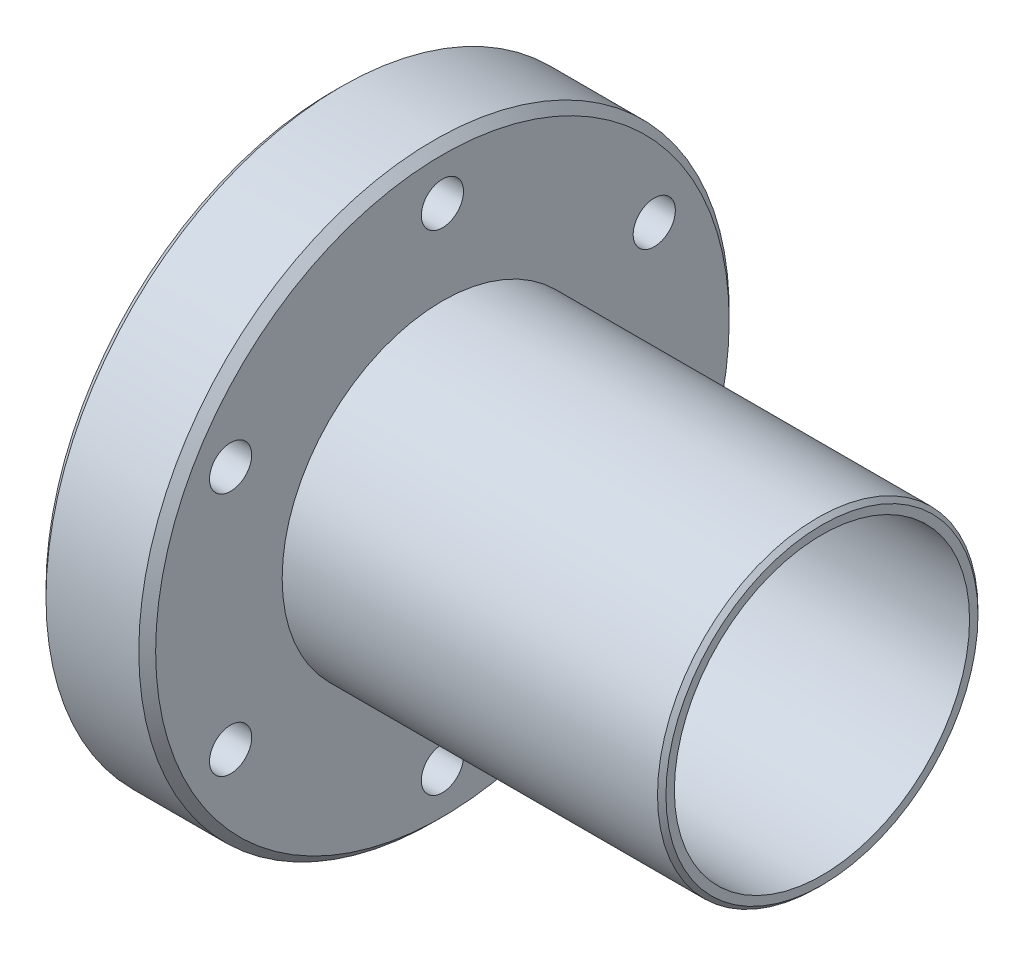
from build123d import *

# Parameters (mm, degrees)
HOLE_WIZARD_M6_1_D       = 5
PATTERN_CIRCULAR_1_COUNT = 6
CHAMFER_1_SIZE           = 1
CHAMFER_2_SIZE           = 1
CHAMFER_3_SIZE           = 0.5


with BuildPart() as part:
    # 스케치1 → 회전1 (revolve)
    with BuildSketch(Plane.XY, mode=Mode.PRIVATE) as revolve_1_sk:
        Polygon((0, 17.5), (0, 35), (13, 35), (13, 19), (58, 19), (58, 17.5), align=None)
    revolve(revolve_1_sk.sketch.rotate(Axis((0, 0, 0), (1, 0, 0)), 90), axis=Axis((0, 0, 0), (1, 0, 0)))

    # M6 나사 구멍1 (through all)
    with Locations(Plane.ZY):
        with Locations((0, 29)):
            hole_wizard_m6_1 = Hole(HOLE_WIZARD_M6_1_D / 2)

    # 원형 패턴1: M6 나사 구멍1 ×6 about axis
    pattern_circular_1_axis = Axis((0, 0, 0), (1, 0, 0))
    for i in range(1, PATTERN_CIRCULAR_1_COUNT):
        add(hole_wizard_m6_1.rotate(pattern_circular_1_axis, i * 360 / PATTERN_CIRCULAR_1_COUNT), mode=Mode.SUBTRACT)

    # 모따기1
    chamfer_1_edges = [part.edges().sort_by_distance(p)[0] for p in [
        (0, 0, -35),
    ]]
    chamfer(chamfer_1_edges, length=CHAMFER_1_SIZE)

    # 모따기2
    chamfer_2_edges = [part.edges().sort_by_distance(p)[0] for p in [
        (13, 0, -35),
    ]]
    chamfer(chamfer_2_edges, length=CHAMFER_2_SIZE)

    # 모따기3
    chamfer_3_edges = [part.edges().sort_by_distance(p)[0] for p in [
        (58, 0, -19),
    ]]
    chamfer(chamfer_3_edges, length=CHAMFER_3_SIZE)


solid = part.part
